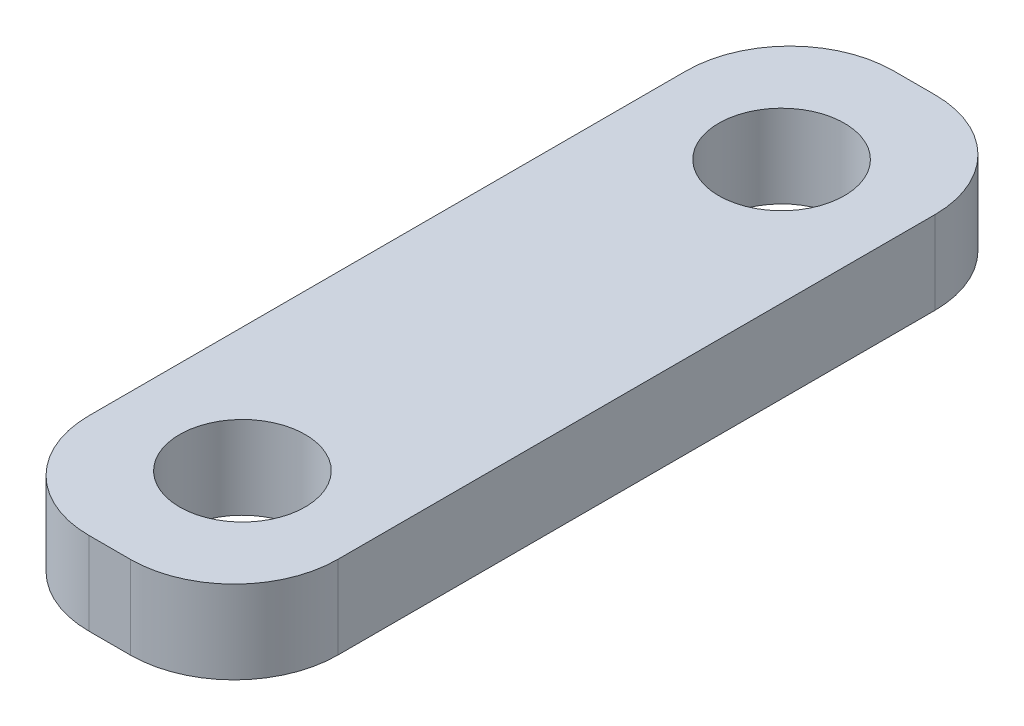
from build123d import *

# Parameters (mm, degrees)
SKETCH_1_R      = 1.515
EXTRUDE_1_DEPTH = 2


with BuildPart() as part:
    # 草图1 → 凸台-拉伸1 (new body)
    with BuildSketch(Plane.XZ):
        with BuildLine():
            Line((6, -16.9), (6, -2.5))
            ThreePointArc((6, -2.5), (5.267766953, -0.732233047), (3.5, 0))
            Line((3.5, 0), (2.5, 0))
            ThreePointArc((2.5, 0), (0.732233047, -0.732233047), (0, -2.5))
            Line((0, -2.5), (0, -16.9))
            ThreePointArc((0, -16.9), (0.732233047, -18.667766953), (2.5, -19.4))
            Line((2.5, -19.4), (3.5, -19.4))
            ThreePointArc((3.5, -19.4), (5.267766953, -18.667766953), (6, -16.9))
        make_face()
        with Locations(Location((3, -3.2, 0), (0, 0, 90))):
            Circle(SKETCH_1_R, mode=Mode.SUBTRACT)
        with Locations(Location((3, -16.2, 0), (0, 0, 90))):
            Circle(SKETCH_1_R, mode=Mode.SUBTRACT)
    extrude(amount=-EXTRUDE_1_DEPTH)


solid = part.part
